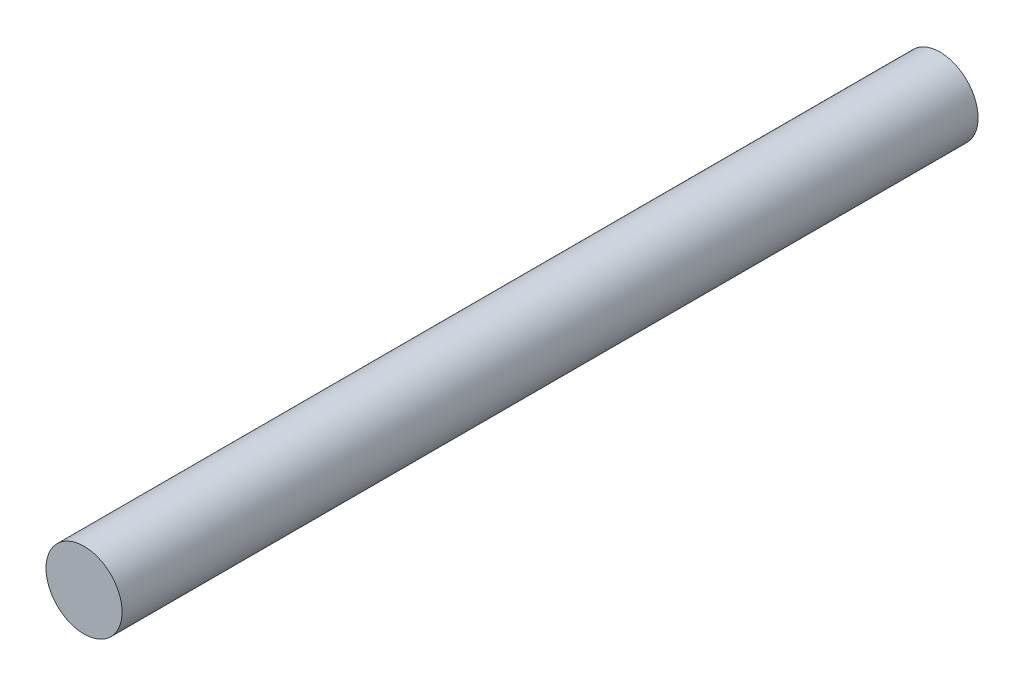
from build123d import *

# Parameters (mm, degrees)
SKETCH1_R           = 2
BOSS_EXTRUDE1_DEPTH = 45


with BuildPart() as part:
    # Sketch1 → Boss-Extrude1 (new body)
    with BuildSketch(Plane.XY):
        with Locations(Location((0, 0, 0), (0, 0, 180))):
            Circle(SKETCH1_R)
    extrude(amount=BOSS_EXTRUDE1_DEPTH)


solid = part.part
